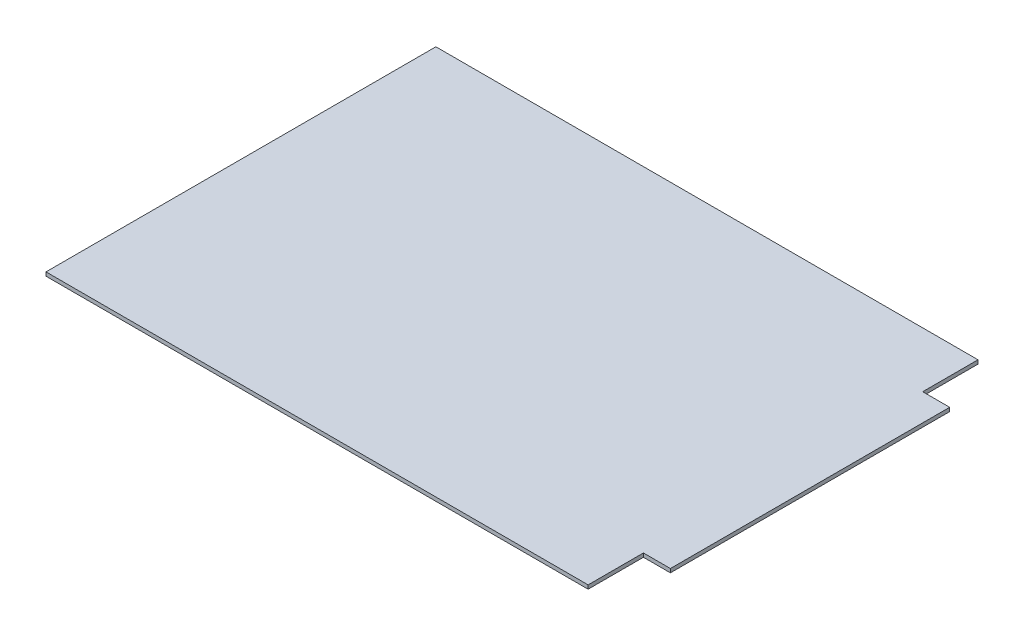
from build123d import *

# Parameters (mm, degrees)
CROQUIS2_W              = 421.86
CROQUIS2_H              = 289
SALIENTE_EXTRUIR1_DEPTH = 2.8
CROQUIS3_W              = 20
CROQUIS3_H              = 41
CORTAR_EXTRUIR1_DEPTH   = 2.8


with BuildPart() as part:
    # Croquis2 → Saliente-Extruir1 (new body)
    with BuildSketch(Plane(origin=(0, 0, 0), x_dir=(1, 0, 0), z_dir=(0, 1, 0))):
        Rectangle(CROQUIS2_W, CROQUIS2_H)
    extrude(amount=SALIENTE_EXTRUIR1_DEPTH)

    # Croquis3 → Cortar-Extruir1 (cut)
    with BuildSketch(Plane(origin=(0, 2.8, 0), x_dir=(1, 0, 0), z_dir=(0, 1, 0))):
        with Locations((200.93, -124)):
            Rectangle(CROQUIS3_W, CROQUIS3_H)
        with Locations((200.93, 124)):
            Rectangle(CROQUIS3_W, CROQUIS3_H)
    extrude(amount=-CORTAR_EXTRUIR1_DEPTH, mode=Mode.SUBTRACT)


solid = part.part
